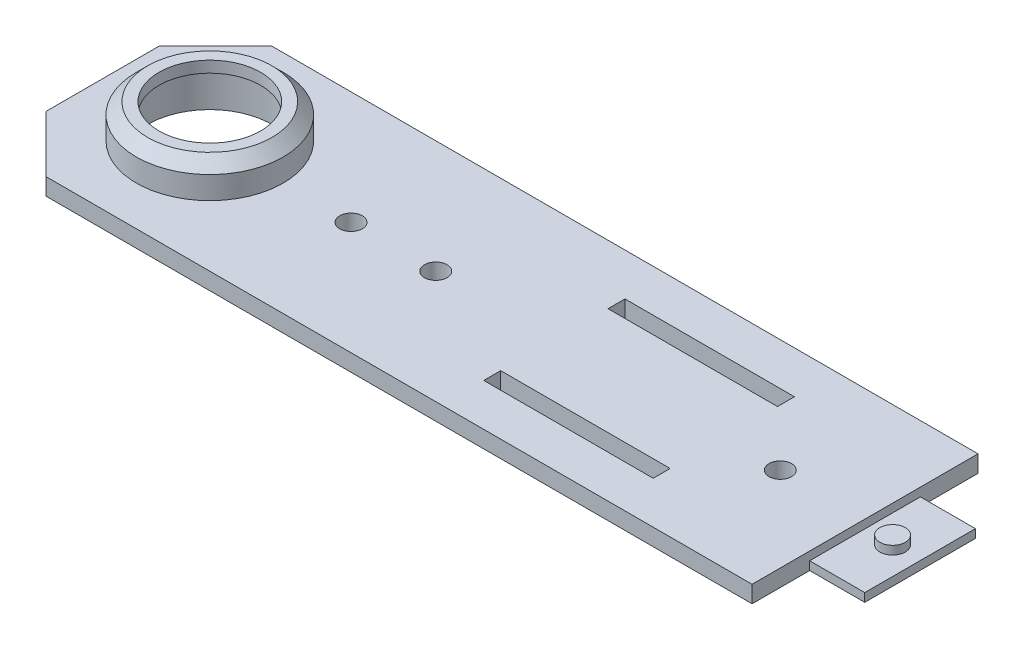
from build123d import *

# Parameters (mm, degrees)
CROQUIS1_R              = 11
CROQUIS1_R_2            = 2
CROQUIS1_W              = 30
CROQUIS1_H              = 3
SALIENTE_EXTRUIR1_DEPTH = 3
CROQUIS2_R              = 13
CROQUIS2_R_2            = 11
SALIENTE_EXTRUIR2_DEPTH = 4
CROQUIS3_R              = 13
CROQUIS3_R_2            = 9
SALIENTE_EXTRUIR3_DEPTH = 2
CHAFL_N1_SIZE           = 2
CHAFL_N2_SIZE           = 10
CROQUIS6_W              = 9.75
CROQUIS6_H              = 19.6
CROQUIS6_R              = 2.25
CORTAR_EXTRUIR2_DEPTH   = 1.5


with BuildPart() as part:
    # Croquis1 → Saliente-Extruir1 (new body)
    with BuildSketch(Plane(origin=(0, 0, 0), x_dir=(1, 0, 0), z_dir=(0, 1, 0))):
        Polygon((-67.5, -20), (67.5, -20), (67.5, -9.8), (77.25, -9.8), (77.25, 9.8), (67.5, 9.8), (67.5, 20), (-67.5, 20), align=None)
        with Locations(Location((-48.5, 0, 0), (0, 0, 270))):
            Circle(CROQUIS1_R, mode=Mode.SUBTRACT)
        with Locations(Location((-23.5, 0, 0), (0, 0, 270))):
            Circle(CROQUIS1_R_2, mode=Mode.SUBTRACT)
        with Locations(Location((-8.5, 0, 0), (0, 0, 270))):
            Circle(CROQUIS1_R_2, mode=Mode.SUBTRACT)
        with Locations(Location((52.5, 0, 0), (0, 0, 270))):
            Circle(CROQUIS1_R_2, mode=Mode.SUBTRACT)
        with Locations((27.5, 11)):
            Rectangle(CROQUIS1_W, CROQUIS1_H, mode=Mode.SUBTRACT)
        with Locations((27.5, -11)):
            Rectangle(CROQUIS1_W, CROQUIS1_H, mode=Mode.SUBTRACT)
    extrude(amount=SALIENTE_EXTRUIR1_DEPTH)

    # Croquis2 → Saliente-Extruir2 (add)
    with BuildSketch(Plane(origin=(0, 3, 0), x_dir=(1, 0, 0), z_dir=(0, 1, 0))):
        with Locations(Location((-48.5, 0, 0), (0, 0, 90))):
            Circle(CROQUIS2_R)
        with Locations(Location((-48.5, 0, 0), (0, 0, 270))):
            Circle(CROQUIS2_R_2, mode=Mode.SUBTRACT)
    extrude(amount=SALIENTE_EXTRUIR2_DEPTH)

    # Croquis3 → Saliente-Extruir3 (add)
    with BuildSketch(Plane(origin=(0, 7, 0), x_dir=(1, 0, 0), z_dir=(0, 1, 0))):
        with Locations(Location((-48.5, 0, 0), (0, 0, 90))):
            Circle(CROQUIS3_R)
        with Locations(Location((-48.5, 0, 0), (0, 0, 270))):
            Circle(CROQUIS3_R_2, mode=Mode.SUBTRACT)
    extrude(amount=SALIENTE_EXTRUIR3_DEPTH)

    # Chaflán1
    chafl_n1_edges = [part.edges().sort_by_distance(p)[0] for p in [
        (-48.5, 9, 13),
    ]]
    chamfer(chafl_n1_edges, length=CHAFL_N1_SIZE)

    # Chaflán2
    chafl_n2_edges = [part.edges().sort_by_distance(p)[0] for p in [
        (-67.5, 1.5, 20),
        (-67.5, 1.5, -20),
    ]]
    chamfer(chafl_n2_edges, length=CHAFL_N2_SIZE)

    # Croquis6 → Cortar-Extruir2 (cut)
    with BuildSketch(Plane(origin=(0, 3, 0), x_dir=(1, 0, 0), z_dir=(0, 1, 0))):
        with Locations((72.375, 0)):
            Rectangle(CROQUIS6_W, CROQUIS6_H)
        with Locations(Location((72.375, 0, 0), (0, 0, 270))):
            Circle(CROQUIS6_R, mode=Mode.SUBTRACT)
    extrude(amount=-CORTAR_EXTRUIR2_DEPTH, mode=Mode.SUBTRACT)


solid = part.part
